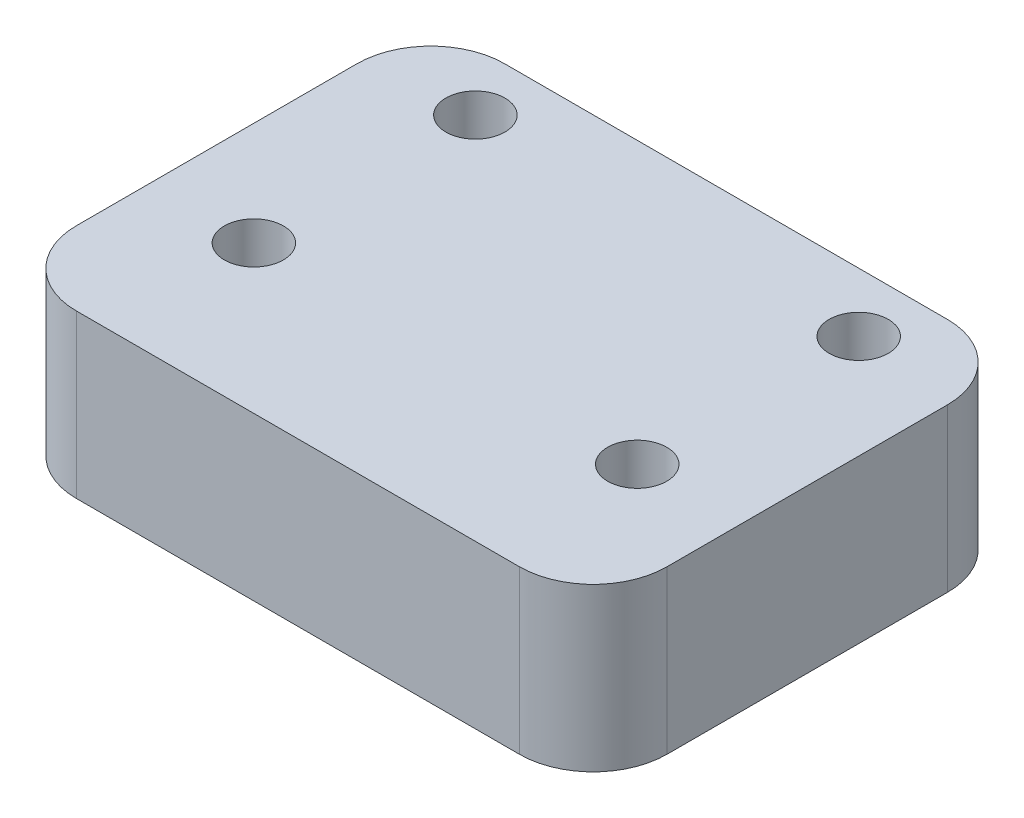
from build123d import *

# Parameters (mm, degrees)
SKETCH_1_W      = 40
SKETCH_1_H      = 29
SKETCH_1_R      = 2
EXTRUDE_1_DEPTH = 11
FILLET_1_R      = 5


with BuildPart() as part:
    # 草圖1 → 填料-伸長1 (new body)
    with BuildSketch(Plane(origin=(0, 0, 0), x_dir=(1, 0, 0), z_dir=(0, 1, 0))):
        Rectangle(SKETCH_1_W, SKETCH_1_H)
        with Locations(Location((12.98, 10.5, 0), (0, 0, 270))):
            Circle(SKETCH_1_R, mode=Mode.SUBTRACT)
        with Locations(Location((-12.98, 10.5, 0), (0, 0, 270))):
            Circle(SKETCH_1_R, mode=Mode.SUBTRACT)
        with Locations(Location((-12.98, -4.5, 0), (0, 0, 270))):
            Circle(SKETCH_1_R, mode=Mode.SUBTRACT)
        with Locations(Location((12.98, -4.5, 0), (0, 0, 270))):
            Circle(SKETCH_1_R, mode=Mode.SUBTRACT)
    extrude(amount=EXTRUDE_1_DEPTH)

    # 圓角1
    fillet_1_edges = [part.edges().sort_by_distance(p)[0] for p in [
        (20, 5.5, 14.5),
        (-20, 5.5, 14.5),
        (-20, 5.5, -14.5),
        (20, 5.5, -14.5),
    ]]
    fillet(fillet_1_edges, radius=FILLET_1_R)


solid = part.part
